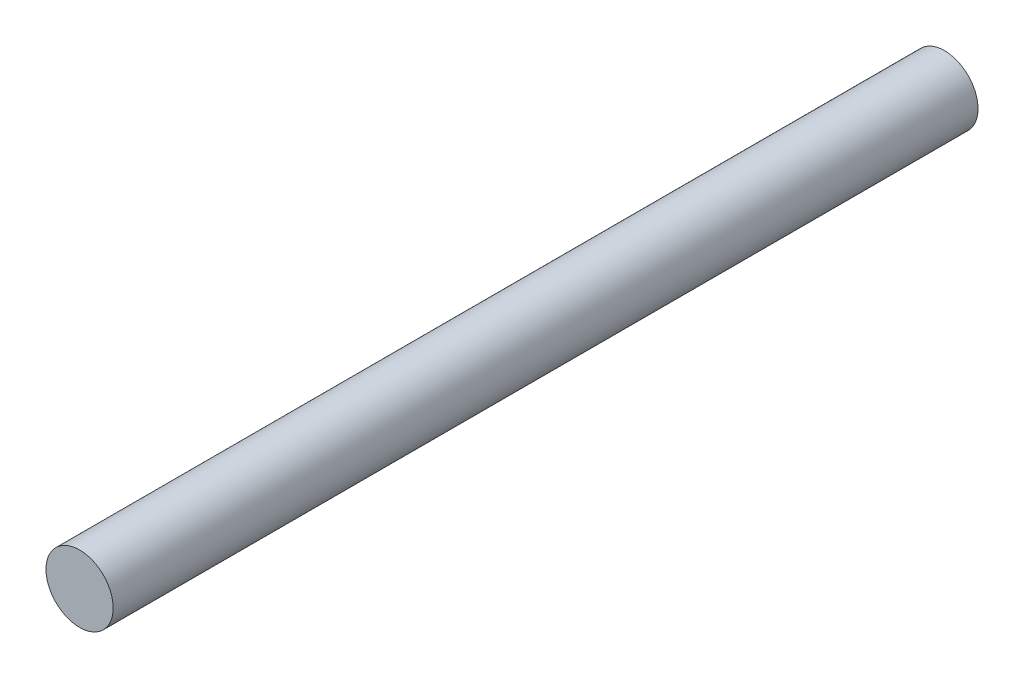
from build123d import *

# Parameters (mm, degrees)
SKETCH_1_R      = 0.8
EXTRUDE_1_DEPTH = 20.6


with BuildPart() as part:
    # 草图1 → 凸台-拉伸1 (new body)
    with BuildSketch(Plane.XY):
        with Locations(Location((0, 0, 0), (0, 0, 180))):
            Circle(SKETCH_1_R)
    extrude(amount=EXTRUDE_1_DEPTH)


solid = part.part
